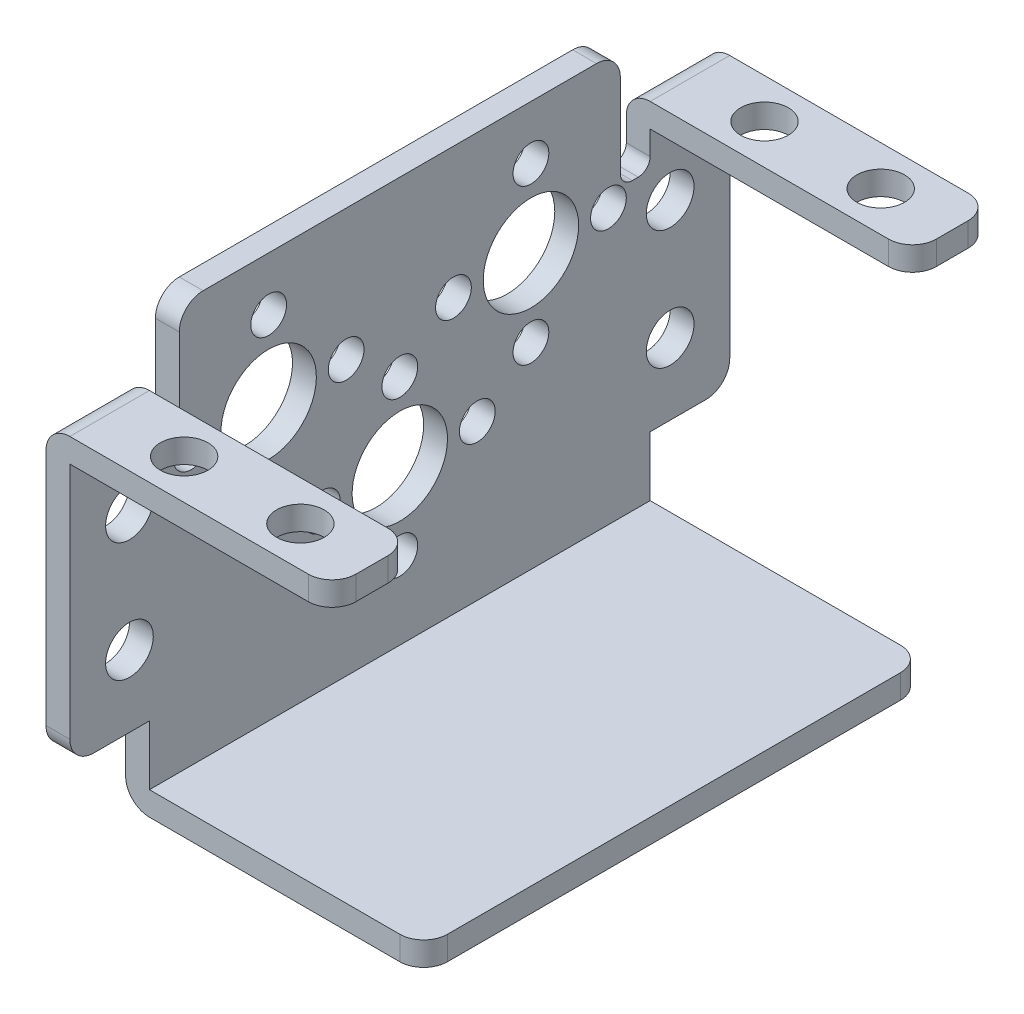
from build123d import *

# Parameters (mm, degrees)
SKETCH2_W           = 25
SKETCH2_H           = 42
BOSS_EXTRUDE1_DEPTH = 36
SKETCH4_W           = 23
SKETCH4_H           = 34
CUT_EXTRUDE2_DEPTH  = 61.704200843
FILLET2_R           = 2
SKETCH5_W           = 2.5
SKETCH5_H           = 10
CUT_EXTRUDE3_DEPTH  = 36
FILLET3_R           = 1
FILLET4_R           = 2
SKETCH7_W           = 6.678436395
SKETCH7_H           = 24
BOSS_EXTRUDE2_DEPTH = 2
FILLET5_R           = 2
SKETCH8_W           = 6.678436395
SKETCH8_H           = 2
BOSS_EXTRUDE5_DEPTH = 22
FILLET6_R           = 2
FILLET7_R           = 2
FILLET8_R           = 2
FILLET9_R           = 1
SKETCH10_R          = 2
SKETCH10_R_2        = 4
SKETCH10_R_3        = 1.5
CUT_EXTRUDE5_DEPTH  = 22
SKETCH11_R          = 2
CUT_EXTRUDE6_DEPTH  = 22
SKETCH14_R          = 1.480718613
SKETCH14_R_2        = 1.5
CUT_EXTRUDE8_DEPTH  = 1


with BuildPart() as part:
    # Sketch2 → Boss-Extrude1 (new body)
    with BuildSketch(Plane(origin=(0, 0, 0), x_dir=(1, 0, 0), z_dir=(0, 1, 0))):
        with Locations((12.5, 0)):
            Rectangle(SKETCH2_W, SKETCH2_H)
    extrude(amount=BOSS_EXTRUDE1_DEPTH)

    # Sketch4 → Cut-Extrude2 (cut, through all)
    with BuildSketch(Plane.XY.offset(21)):
        with Locations((13.5, 19)):
            Rectangle(SKETCH4_W, SKETCH4_H)
    extrude(amount=-CUT_EXTRUDE2_DEPTH, mode=Mode.SUBTRACT)

    # Fillet2
    fillet2_edges = [part.edges().sort_by_distance(p)[0] for p in [
        (25, 1, 21),
        (25, 1, -21),
    ]]
    fillet(fillet2_edges, radius=FILLET2_R)

    # Sketch5 → Cut-Extrude3 (cut)
    with BuildSketch(Plane(origin=(2, 0, 0), x_dir=(0, 0, -1), z_dir=(1, 0, 0))):
        with Locations((-19.75, 31)):
            Rectangle(SKETCH5_W, SKETCH5_H)
        with Locations((19.75, 31)):
            Rectangle(SKETCH5_W, SKETCH5_H)
    extrude(amount=-CUT_EXTRUDE3_DEPTH, mode=Mode.SUBTRACT)

    # Fillet3
    fillet3_edges = [part.edges().sort_by_distance(p)[0] for p in [
        (1, 26, 18.5),
        (1, 26, -18.5),
    ]]
    fillet(fillet3_edges, radius=FILLET3_R)

    # Fillet4
    fillet4_edges = [part.edges().sort_by_distance(p)[0] for p in [
        (1, 36, 18.5),
        (1, 36, -18.5),
    ]]
    fillet(fillet4_edges, radius=FILLET4_R)

    # Sketch7 → Boss-Extrude2 (add)
    with BuildSketch(Plane(origin=(2, 0, 0), x_dir=(0, 0, -1), z_dir=(1, 0, 0))):
        with Locations((-24.339218198, 19)):
            Rectangle(SKETCH7_W, SKETCH7_H)
        with Locations((24.339218198, 19)):
            Rectangle(SKETCH7_W, SKETCH7_H)
    extrude(amount=-BOSS_EXTRUDE2_DEPTH)

    # Fillet5
    fillet5_edges = [part.edges().sort_by_distance(p)[0] for p in [
        (1, 7, 27.678436395),
        (1, 7, -27.678436395),
    ]]
    fillet(fillet5_edges, radius=FILLET5_R)

    # Sketch8 → Boss-Extrude5 (add)
    with BuildSketch(Plane(origin=(2, 0, 0), x_dir=(0, 0, -1), z_dir=(1, 0, 0))):
        with Locations((-24.339218198, 30)):
            Rectangle(SKETCH8_W, SKETCH8_H)
        with Locations((24.339218198, 30)):
            Rectangle(SKETCH8_W, SKETCH8_H)
    extrude(amount=BOSS_EXTRUDE5_DEPTH)

    # Fillet6
    fillet6_edges = [part.edges().sort_by_distance(p)[0] for p in [
        (24, 30, 27.678436395),
        (24, 30, 21),
        (24, 30, -21),
        (24, 30, -27.678436395),
    ]]
    fillet(fillet6_edges, radius=FILLET6_R)

    # Fillet7
    fillet7_edges = [part.edges().sort_by_distance(p)[0] for p in [
        (0, 31, 24.339218197),
        (0, 31, -24.339218197),
    ]]
    fillet(fillet7_edges, radius=FILLET7_R)

    # Fillet8
    fillet8_edges = [part.edges().sort_by_distance(p)[0] for p in [
        (0, 0, 0),
    ]]
    fillet(fillet8_edges, radius=FILLET8_R)

    # Fillet9
    fillet9_edges = [part.edges().sort_by_distance(p)[0] for p in [
        (1, 26, 21),
        (1, 26, -21),
    ]]
    fillet(fillet9_edges, radius=FILLET9_R)

    # Sketch10 → Cut-Extrude5 (cut)
    with BuildSketch(Plane(origin=(2, 0, 0), x_dir=(0, 0, -1), z_dir=(1, 0, 0))):
        with Locations(Location((-22.678436395, 13, 0), (0, 0, 90))):
            Circle(SKETCH10_R)
        with Locations(Location((-22.678436395, 23, 0), (0, 0, 90))):
            Circle(SKETCH10_R)
        with Locations((22.678436395, 13)):
            Circle(SKETCH10_R)
        with Locations((22.678436395, 23)):
            Circle(SKETCH10_R)
        with Locations(Location((-11, 25, 0), (0, 0, 90))):
            Circle(SKETCH10_R_2)
        with Locations(Location((-11, 31.5, 0), (0, 0, 90))):
            Circle(SKETCH10_R_3)
        with Locations(Location((-11, 18.5, 0), (0, 0, 90))):
            Circle(SKETCH10_R_3)
        with Locations(Location((-17.5, 25, 0), (0, 0, 90))):
            Circle(SKETCH10_R_3)
        with Locations(Location((-4.5, 25, 0), (0, 0, 90))):
            Circle(SKETCH10_R_3)
        with Locations((11, 18.5)):
            Circle(SKETCH10_R_3)
        with Locations((4.5, 25)):
            Circle(SKETCH10_R_3)
        with Locations((17.5, 25)):
            Circle(SKETCH10_R_3)
        with Locations((11, 31.5)):
            Circle(SKETCH10_R_3)
        with Locations((11, 25)):
            Circle(SKETCH10_R_2)
        with Locations(Location((0, 15, 0), (0, 0, 90))):
            Circle(SKETCH10_R_2)
        with Locations(Location((6.5, 15, 0), (0, 0, 90))):
            Circle(SKETCH10_R_3)
        with Locations(Location((0, 8.5, 0), (0, 0, 90))):
            Circle(SKETCH10_R_3)
        with Locations(Location((0, 21.5, 0), (0, 0, 90))):
            Circle(SKETCH10_R_3)
        with Locations((-6.5, 15)):
            Circle(SKETCH10_R_3)
    extrude(amount=-CUT_EXTRUDE5_DEPTH, mode=Mode.SUBTRACT)

    # Sketch11 → Cut-Extrude6 (cut)
    with BuildSketch(Plane(origin=(0, 31, 0), x_dir=(1, 0, 0), z_dir=(0, 1, 0))):
        with Locations(Location((18, -24.339218197, 0), (0, 0, 270))):
            Circle(SKETCH11_R)
        with Locations(Location((8.25, -24.339218197, 0), (0, 0, 270))):
            Circle(SKETCH11_R)
        with Locations(Location((18, 24.339218197, 0), (0, 0, 180))):
            Circle(SKETCH11_R)
        with Locations(Location((8.25, 24.339218197, 0), (0, 0, 180))):
            Circle(SKETCH11_R)
    extrude(amount=-CUT_EXTRUDE6_DEPTH, mode=Mode.SUBTRACT)

    # Sketch14 → Cut-Extrude8 (cut)
    with BuildSketch(Plane.XZ):
        with Locations(Location((13.12, 8.82, 0), (0, 0, 270))):
            Circle(SKETCH14_R)
        with Locations(Location((19.62, 9.215317048, 0), (0, 0, 270))):
            Circle(SKETCH14_R_2)
        with Locations(Location((6.62, 9.215317048, 0), (0, 0, 270))):
            Circle(SKETCH14_R_2)
        with Locations(Location((12.800679274, 15.312151745, 0), (0, 0, 270))):
            Circle(SKETCH14_R_2)
        with Locations(Location((12.917346355, 2.32, 0), (0, 0, 270))):
            Circle(SKETCH14_R_2)
        with Locations(Location((12.917346355, -2.32, 0), (0, 0, 90))):
            Circle(SKETCH14_R_2)
        with Locations(Location((19.62, -9.215317048, 0), (0, 0, 90))):
            Circle(SKETCH14_R_2)
        with Locations(Location((13.12, -8.82, 0), (0, 0, 90))):
            Circle(SKETCH14_R)
        with Locations(Location((6.62, -9.215317048, 0), (0, 0, 90))):
            Circle(SKETCH14_R_2)
        with Locations(Location((12.800679274, -15.312151745, 0), (0, 0, 90))):
            Circle(SKETCH14_R_2)
    extrude(amount=-CUT_EXTRUDE8_DEPTH, mode=Mode.SUBTRACT)


solid = part.part
